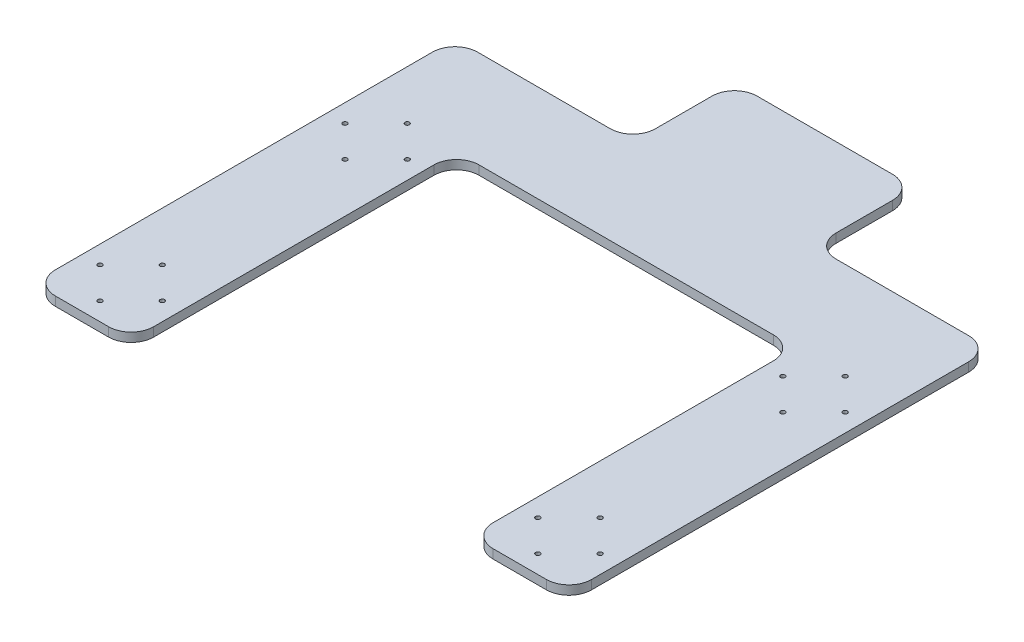
from build123d import *

# Parameters (mm, degrees)
SKETCH3_R           = 0.635
BOSS_EXTRUDE2_DEPTH = 2.54
SKETCH4_W           = 165.279862668
SKETCH4_H           = 127
CUT_EXTRUDE1_DEPTH  = 125.579462115
FILLET3_R           = 6.35


with BuildPart() as part:
    # Sketch3 → Boss-Extrude2 (new body)
    with BuildSketch(Plane(origin=(0, 0, 0), x_dir=(1, 0, 0), z_dir=(0, 1, 0))):
        Polygon((-75.438, 48.30953), (-75.438, -99.10953), (-47.752, -99.10953), (-47.752, 3.51009118), (-47.752, 43.22953), (47.752, 43.22953), (47.752, 3.51009118), (47.752, -99.10953), (75.438, -99.10953), (75.438, 48.30953), (75.438, 70.50296882), (25.4, 70.50296882), (25.4, 99.10953), (-25.4, 99.10953), (-25.4, 70.50296882), (-75.438, 70.50296882), align=None)
        with Locations(Location((-61.595, 43.22953, 0), (0, 0, 270))):
            Circle(SKETCH3_R, mode=Mode.SUBTRACT)
        with Locations(Location((-70.358, 34.46653, 0), (0, 0, 270))):
            Circle(SKETCH3_R, mode=Mode.SUBTRACT)
        with Locations(Location((-61.595, 25.70353, 0), (0, 0, 270))):
            Circle(SKETCH3_R, mode=Mode.SUBTRACT)
        with Locations(Location((-52.832, 34.46653, 0), (0, 0, 270))):
            Circle(SKETCH3_R, mode=Mode.SUBTRACT)
        with Locations(Location((-52.832, -34.46653, 0), (0, 0, 90))):
            Circle(SKETCH3_R, mode=Mode.SUBTRACT)
        with Locations(Location((-61.595, -25.70353, 0), (0, 0, 90))):
            Circle(SKETCH3_R, mode=Mode.SUBTRACT)
        with Locations(Location((-70.358, -34.46653, 0), (0, 0, 90))):
            Circle(SKETCH3_R, mode=Mode.SUBTRACT)
        with Locations(Location((-61.595, -43.22953, 0), (0, 0, 90))):
            Circle(SKETCH3_R, mode=Mode.SUBTRACT)
        with Locations(Location((61.595, -43.22953, 0), (0, 0, 270))):
            Circle(SKETCH3_R, mode=Mode.SUBTRACT)
        with Locations(Location((61.595, -25.70353, 0), (0, 0, 270))):
            Circle(SKETCH3_R, mode=Mode.SUBTRACT)
        with Locations(Location((52.832, -34.46653, 0), (0, 0, 270))):
            Circle(SKETCH3_R, mode=Mode.SUBTRACT)
        with Locations(Location((52.832, 34.46653, 0), (0, 0, 90))):
            Circle(SKETCH3_R, mode=Mode.SUBTRACT)
        with Locations(Location((61.595, 25.70353, 0), (0, 0, 90))):
            Circle(SKETCH3_R, mode=Mode.SUBTRACT)
        with Locations(Location((61.595, 43.22953, 0), (0, 0, 90))):
            Circle(SKETCH3_R, mode=Mode.SUBTRACT)
        with Locations(Location((70.358, -34.46653, 0), (0, 0, 270))):
            Circle(SKETCH3_R, mode=Mode.SUBTRACT)
        with Locations(Location((70.358, 34.46653, 0), (0, 0, 270))):
            Circle(SKETCH3_R, mode=Mode.SUBTRACT)
    extrude(amount=BOSS_EXTRUDE2_DEPTH)

    # Sketch4 → Cut-Extrude1 (cut, through all)
    with BuildSketch(Plane(origin=(0, 2.54, 0), x_dir=(1, 0, 0), z_dir=(0, 1, 0))):
        with Locations((3.512659274, -111.80953)):
            Rectangle(SKETCH4_W, SKETCH4_H)
    extrude(amount=-CUT_EXTRUDE1_DEPTH, mode=Mode.SUBTRACT)

    # Fillet3
    fillet3_edges = [part.edges().sort_by_distance(p)[0] for p in [
        (75.438, 1.27, 48.30953),
        (-75.438, 1.27, 48.30953),
        (-47.752, 1.27, 48.30953),
        (47.752, 1.27, 48.30953),
        (-75.438, 1.27, -70.50296882),
        (-25.4, 1.27, -70.50296882),
        (-25.4, 1.27, -99.10953),
        (25.4, 1.27, -99.10953),
        (25.4, 1.27, -70.50296882),
        (75.438, 1.27, -70.50296882),
        (47.752, 1.27, -43.22953),
        (-47.752, 1.27, -43.22953),
    ]]
    fillet(fillet3_edges, radius=FILLET3_R)


solid = part.part
